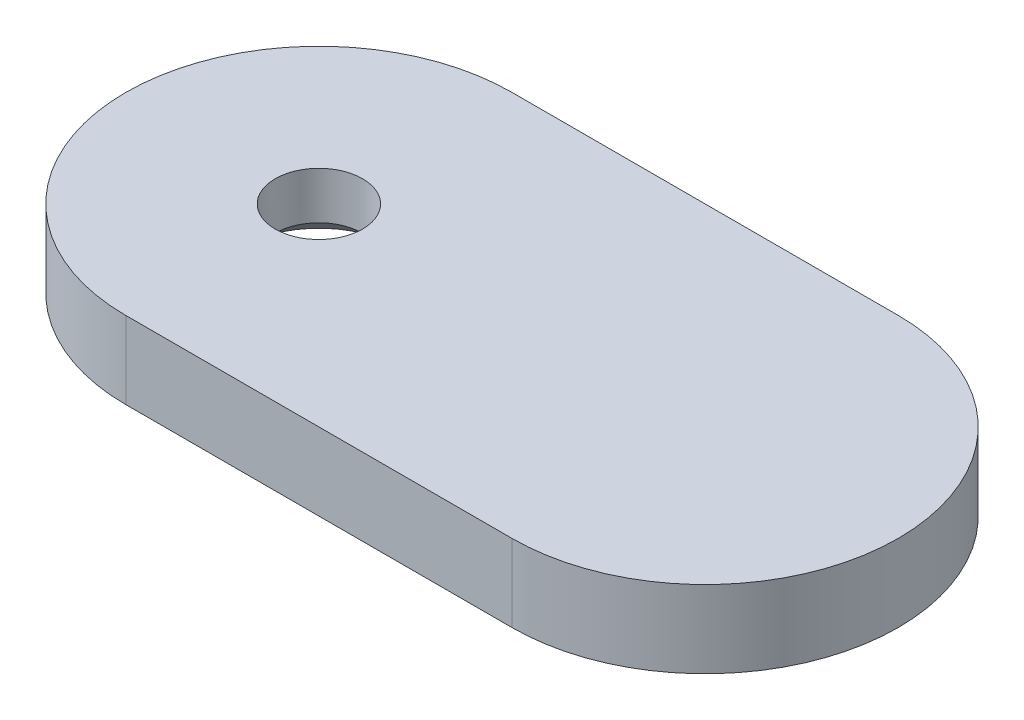
from build123d import *

# Parameters (mm, degrees)
BOSS_EXTRUDE1_DEPTH             = 2
F_4_40_TAPPED_HOLE4_D           = 2.2606
F_4_40_TAPPED_HOLE4_DEPTH       = 30
F_4_40_TAPPED_HOLE4_CSINK_D     = 4.1148
F_4_40_TAPPED_HOLE4_CSINK_ANGLE = 100
F_4_40_TAPPED_HOLE4_TIP         = 0.679152758


with BuildPart() as part:
    # Sketch1 → Boss-Extrude1 (new body)
    with BuildSketch(Plane(origin=(0, 0, 0), x_dir=(1, 0, 0), z_dir=(0, 1, 0))):
        with BuildLine():
            Line((-6.920754264, 5), (3.079245736, 5))
            ThreePointArc((3.079245736, 5), (8.079245736, 0), (3.079245736, -5))
            Line((3.079245736, -5), (-6.920754264, -5))
            ThreePointArc((-6.920754264, -5), (-11.920754264, 0), (-6.920754264, 5))
        make_face()
    extrude(amount=BOSS_EXTRUDE1_DEPTH)

    # #4-40 Tapped Hole4
    with Locations(Plane(origin=(-19.632131664, 0, 165.681232686), x_dir=(0.5683283048470524, 0, -0.8228018825389717), z_dir=(0, -1, 0))):
        with Locations((143.547065725, -83.702388863)):
            CounterSinkHole(F_4_40_TAPPED_HOLE4_D / 2, F_4_40_TAPPED_HOLE4_CSINK_D / 2, depth=F_4_40_TAPPED_HOLE4_DEPTH, counter_sink_angle=F_4_40_TAPPED_HOLE4_CSINK_ANGLE)
            with Locations((0, 0, -(F_4_40_TAPPED_HOLE4_DEPTH + F_4_40_TAPPED_HOLE4_TIP / 2))):  # 118° drill point
                Cone(0, F_4_40_TAPPED_HOLE4_D / 2, F_4_40_TAPPED_HOLE4_TIP, mode=Mode.SUBTRACT)


solid = part.part
